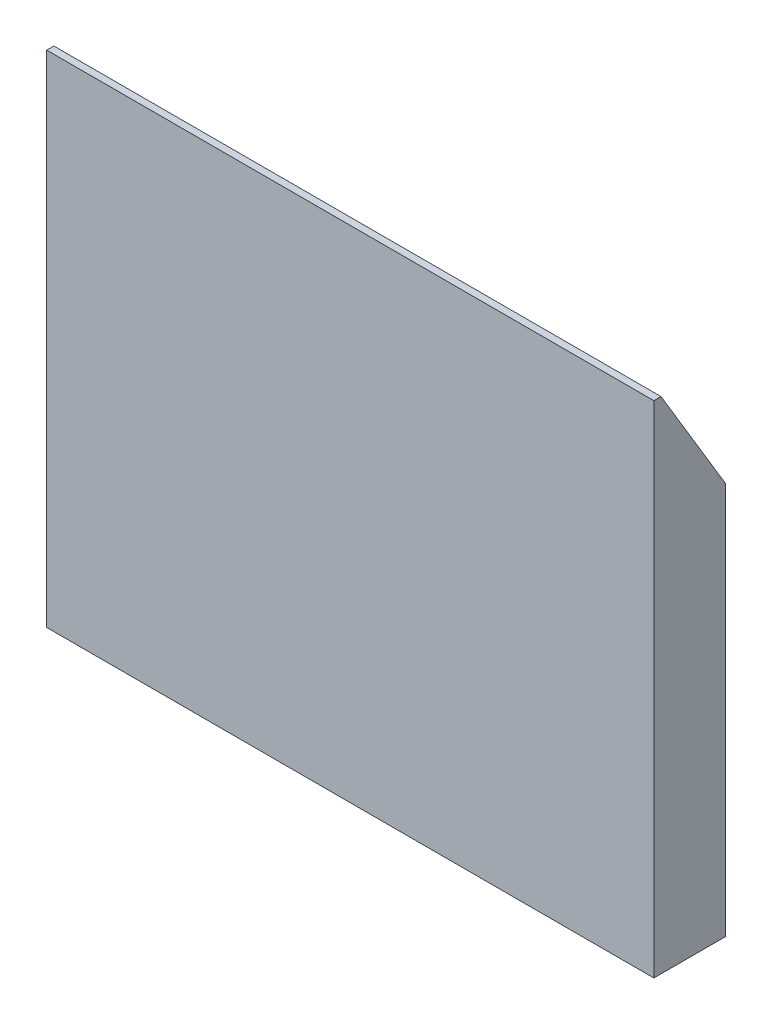
from build123d import *

# Parameters (mm, degrees)
BOSS_EXTRUDE1_DEPTH     = 70
CUT_EXTRUDE2_DEPTH      = 83.5
CUT_EXTRUDE2_DEPTH_BACK = 83.5


with BuildPart() as part:
    # Sketch1 → Boss-Extrude1 (new body)
    with BuildSketch(Plane(origin=(0, 0, 0), x_dir=(1, 0, 0), z_dir=(0, 1, 0))):
        Polygon((-42.5, 0), (42.5, 0), (42.5, 10), (41.5, 10), (41.5, 1), (-41.5, 1), (-41.5, 10), (-42.5, 10), align=None)
    extrude(amount=BOSS_EXTRUDE1_DEPTH)

    # Sketch2 → Cut-Extrude2 (cut, two sides: drawn at the far end of the back side and taken through both)
    with BuildSketch(Plane(origin=(0, 0, 0), x_dir=(0, 0, -1), z_dir=(1, 0, 0)).offset(-CUT_EXTRUDE2_DEPTH_BACK)):
        Polygon((1, 70), (10, 55), (10, 70), align=None)
    extrude(amount=CUT_EXTRUDE2_DEPTH + CUT_EXTRUDE2_DEPTH_BACK, mode=Mode.SUBTRACT)


solid = part.part
